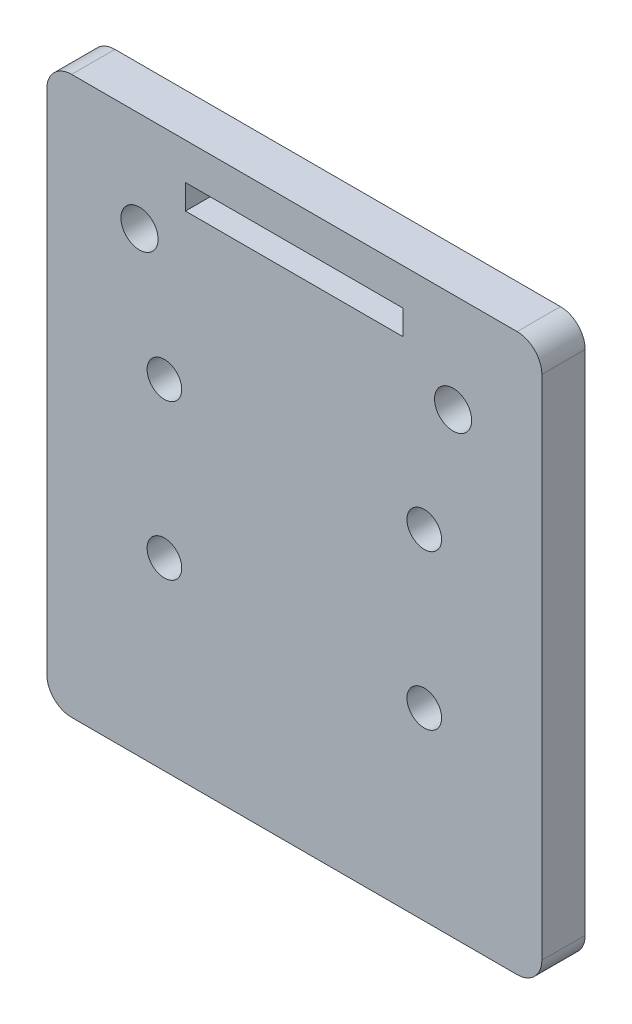
from build123d import *

# Parameters (mm, degrees)
BOSS_EXTRUDE1_DEPTH = 3.5
SKETCH2_W           = 8.8
SKETCH2_H           = 2
CUT_EXTRUDE1_DEPTH  = 61.309617744
SKETCH3_R           = 1.5
CUT_EXTRUDE2_DEPTH  = 61.309617744
SKETCH4_R           = 1.4
CUT_EXTRUDE3_DEPTH  = 61.309617744


with BuildPart() as part:
    # Sketch1 → Boss-Extrude1 (new body)
    with BuildSketch(Plane.XY):
        with BuildLine():
            Line((-2, 0), (-38, 0))
            ThreePointArc((-38, 0), (-39.414213562, 0.585786438), (-40, 2))
            Line((-40, 2), (-40, 42.999999916))
            ThreePointArc((-40, 42.999999916), (-39.414213562, 44.414213478), (-38, 44.999999916))
            Line((-38, 44.999999916), (-2, 44.999999916))
            ThreePointArc((-2, 44.999999916), (-0.585786438, 44.414213478), (0, 42.999999916))
            Line((0, 42.999999916), (0, 2))
            ThreePointArc((0, 2), (-0.585786438, 0.585786438), (-2, 0))
        make_face()
    extrude(amount=BOSS_EXTRUDE1_DEPTH)

    # Sketch2 → Cut-Extrude1 (cut, through all)
    with BuildSketch(Plane.XY.offset(3.5)):
        with Locations((-24.4, 41.033946817)):
            Rectangle(SKETCH2_W, SKETCH2_H)
        with Locations((-15.6, 41.033946817)):
            Rectangle(SKETCH2_W, SKETCH2_H)
    extrude(amount=-CUT_EXTRUDE1_DEPTH, mode=Mode.SUBTRACT)

    # Sketch3 → Cut-Extrude2 (cut, through all)
    with BuildSketch(Plane.XY.offset(3.5)):
        with Locations((-32.512621431, 36.953417216)):
            Circle(SKETCH3_R)
        with Locations((-7.172621431, 36.953417216)):
            Circle(SKETCH3_R)
    extrude(amount=-CUT_EXTRUDE2_DEPTH, mode=Mode.SUBTRACT)

    # Sketch4 → Cut-Extrude3 (cut, through all)
    with BuildSketch(Plane.XY.offset(3.5)):
        with Locations((-30.5, 27.406241852)):
            Circle(SKETCH4_R)
        with Locations((-30.5, 14.906241852)):
            Circle(SKETCH4_R)
        with Locations((-9.5, 14.906241852)):
            Circle(SKETCH4_R)
        with Locations((-9.5, 27.406241852)):
            Circle(SKETCH4_R)
    extrude(amount=-CUT_EXTRUDE3_DEPTH, mode=Mode.SUBTRACT)


solid = part.part
